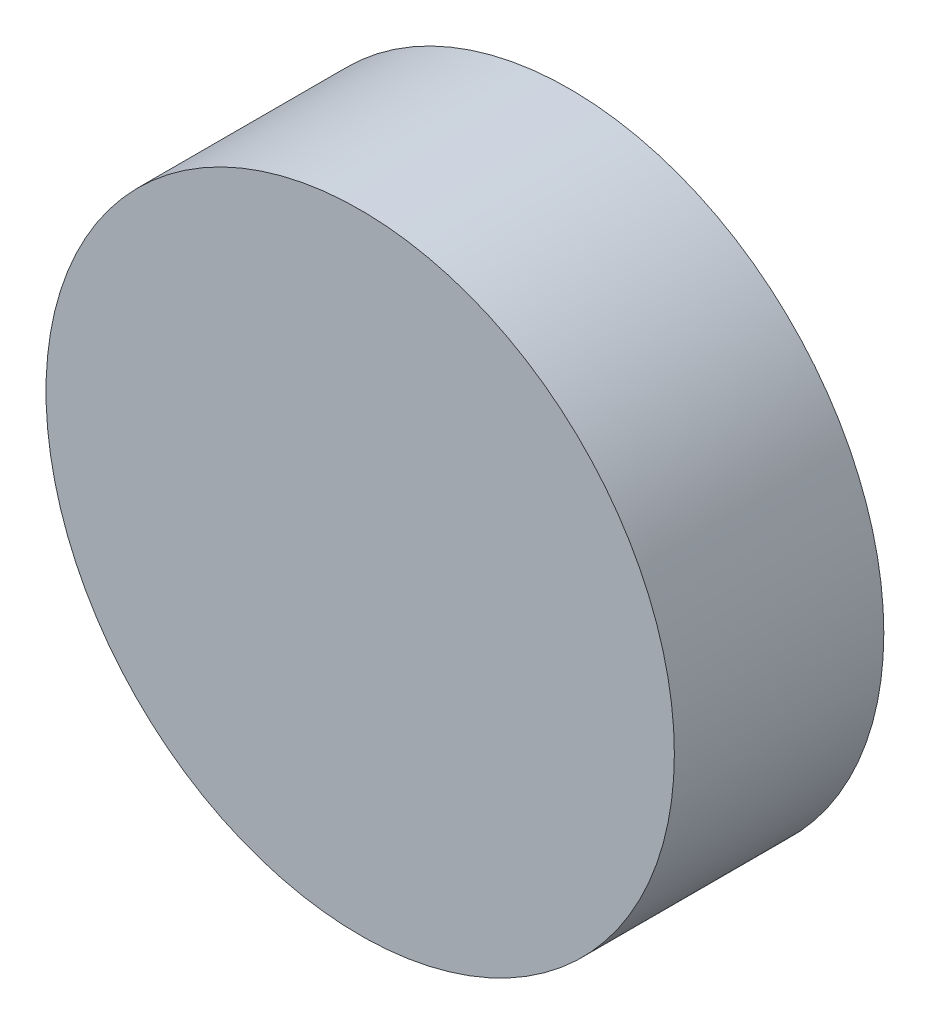
from build123d import *

# Parameters (mm, degrees)
SKETCH_1_R = 1.65
DISC_DEPTH = 1.1


with BuildPart() as part:
    # 草图1 → Disc (new body)
    with BuildSketch(Plane.XY):
        Circle(SKETCH_1_R)
    extrude(amount=DISC_DEPTH)


solid = part.part
